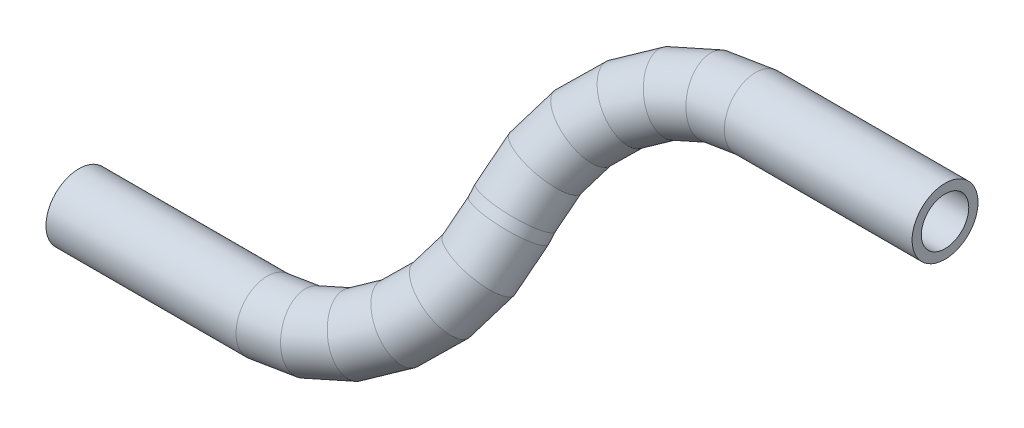
from build123d import *

# Parameters (mm, degrees)
PROFILE_R   = 3.175
PROFILE_R_2 = 2.286


with BuildPart() as part:
    # Tube: sweep along a curve in space
    with BuildLine() as tube_path:
        Line((-2754.892778381, -26.697560814, 19.396913326), (-2773.092778381, -26.697560814, 19.396913326))
        Line((-2773.092778381, -26.697560814, 19.396913326), (-2776.813899846, -27.076898087, 19.672517987))
        Line((-2776.813899846, -27.076898087, 19.672517987), (-2780.302383419, -28.191194413, 20.482101656))
        Line((-2780.302383419, -28.191194413, 20.482101656), (-2783.340135312, -29.970785969, 21.775050604))
        Line((-2783.340135312, -29.970785969, 21.775050604), (-2785.737240684, -32.304415858, 23.470531963))
        Line((-2785.737240684, -32.304415858, 23.470531963), (-2787.34383677, -35.046189691, 25.462547255))
        Line((-2787.34383677, -35.046189691, 25.462547255), (-2788.059482043, -38.024696646, 27.626559228))
        Line((-2788.059482043, -38.024696646, 27.626559228), (-2788.126074718, -38.83191782, 28.21303974))
        Line((-2788.126074718, -38.83191782, 28.21303974), (-2788.841719991, -41.810424775, 30.377051713))
        Line((-2788.841719991, -41.810424775, 30.377051713), (-2790.448316078, -44.552198608, 32.369067005))
        Line((-2790.448316078, -44.552198608, 32.369067005), (-2792.845421449, -46.885828496, 34.064548363))
        Line((-2792.845421449, -46.885828496, 34.064548363), (-2795.883173343, -48.665420053, 35.357497311))
        Line((-2795.883173343, -48.665420053, 35.357497311), (-2799.371656915, -49.779716379, 36.167080981))
        Line((-2799.371656915, -49.779716379, 36.167080981), (-2803.092778381, -50.159053651, 36.442685642))
        Line((-2803.092778381, -50.159053651, 36.442685642), (-2821.292778381, -50.159053651, 36.442685642))
    # Profile → Tube (sweep)
    with BuildSketch(Plane(origin=(-2754.892778381, 0, 0), x_dir=(0, 0, -1), z_dir=(1, 0, 0))):
        with Locations((-19.396913326, -26.697560814)):
            Circle(PROFILE_R)
        with Locations((-19.396913326, -26.697560814)):
            Circle(PROFILE_R_2, mode=Mode.SUBTRACT)
    sweep(path=tube_path.line, transition=Transition.RIGHT)


solid = part.part
